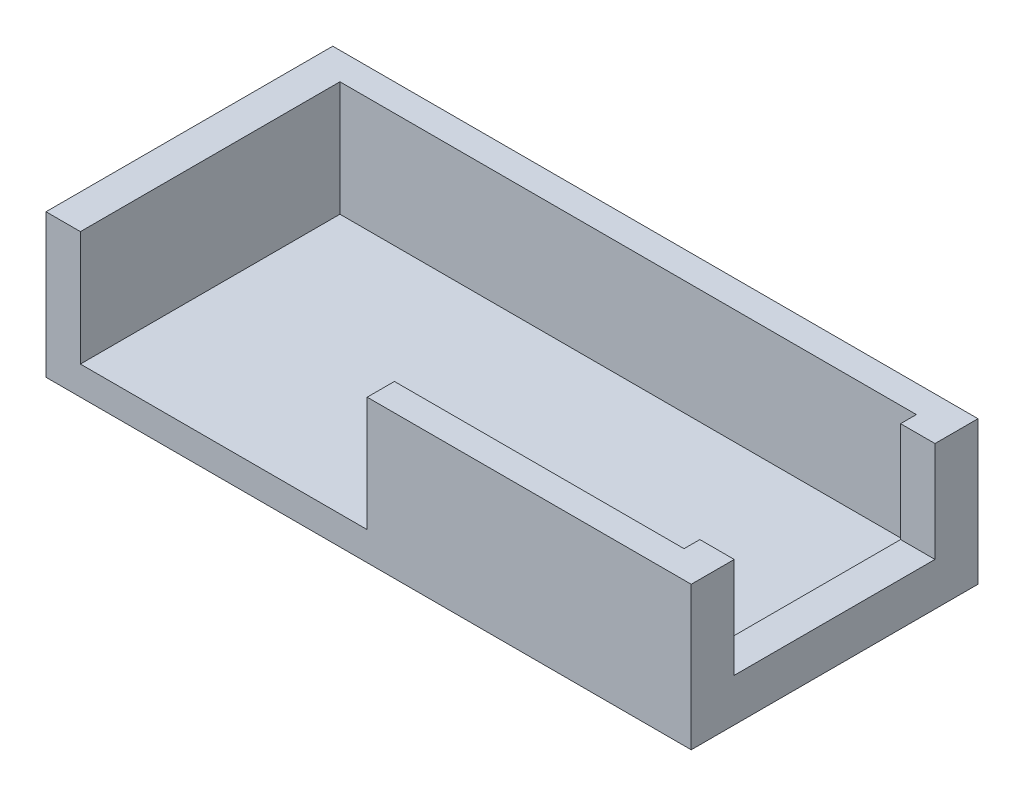
from build123d import *

# Parameters (mm, degrees)
CROQUIS1_W              = 45
CROQUIS1_H              = 20
SALIENTE_EXTRUIR1_DEPTH = 10
CROQUIS2_W              = 40.2
CROQUIS2_H              = 16.2
CORTAR_EXTRUIR1_DEPTH   = 8
CROQUIS3_W              = 14
CROQUIS3_H              = 7
CORTAR_EXTRUIR2_DEPTH   = 8
CROQUIS4_W              = 20
CROQUIS4_H              = 8
CORTAR_EXTRUIR3_DEPTH   = 8


with BuildPart() as part:
    # Croquis1 → Saliente-Extruir1 (new body)
    with BuildSketch(Plane(origin=(0, 0, 0), x_dir=(1, 0, 0), z_dir=(0, 1, 0))):
        Rectangle(CROQUIS1_W, CROQUIS1_H)
    extrude(amount=SALIENTE_EXTRUIR1_DEPTH)

    # Croquis2 → Cortar-Extruir1 (cut)
    with BuildSketch(Plane(origin=(0, 10, 0), x_dir=(1, 0, 0), z_dir=(0, 1, 0))):
        Rectangle(CROQUIS2_W, CROQUIS2_H)
    extrude(amount=-CORTAR_EXTRUIR1_DEPTH, mode=Mode.SUBTRACT)

    # Croquis3 → Cortar-Extruir2 (cut)
    with BuildSketch(Plane(origin=(22.5, 0, 0), x_dir=(0, 0, -1), z_dir=(1, 0, 0))):
        with Locations((0, 6.5)):
            Rectangle(CROQUIS3_W, CROQUIS3_H)
    extrude(amount=-CORTAR_EXTRUIR2_DEPTH, mode=Mode.SUBTRACT)

    # Croquis4 → Cortar-Extruir3 (cut)
    with BuildSketch(Plane.XY.offset(10)):
        with Locations((-10.1, 6)):
            Rectangle(CROQUIS4_W, CROQUIS4_H)
    extrude(amount=-CORTAR_EXTRUIR3_DEPTH, mode=Mode.SUBTRACT)


solid = part.part
